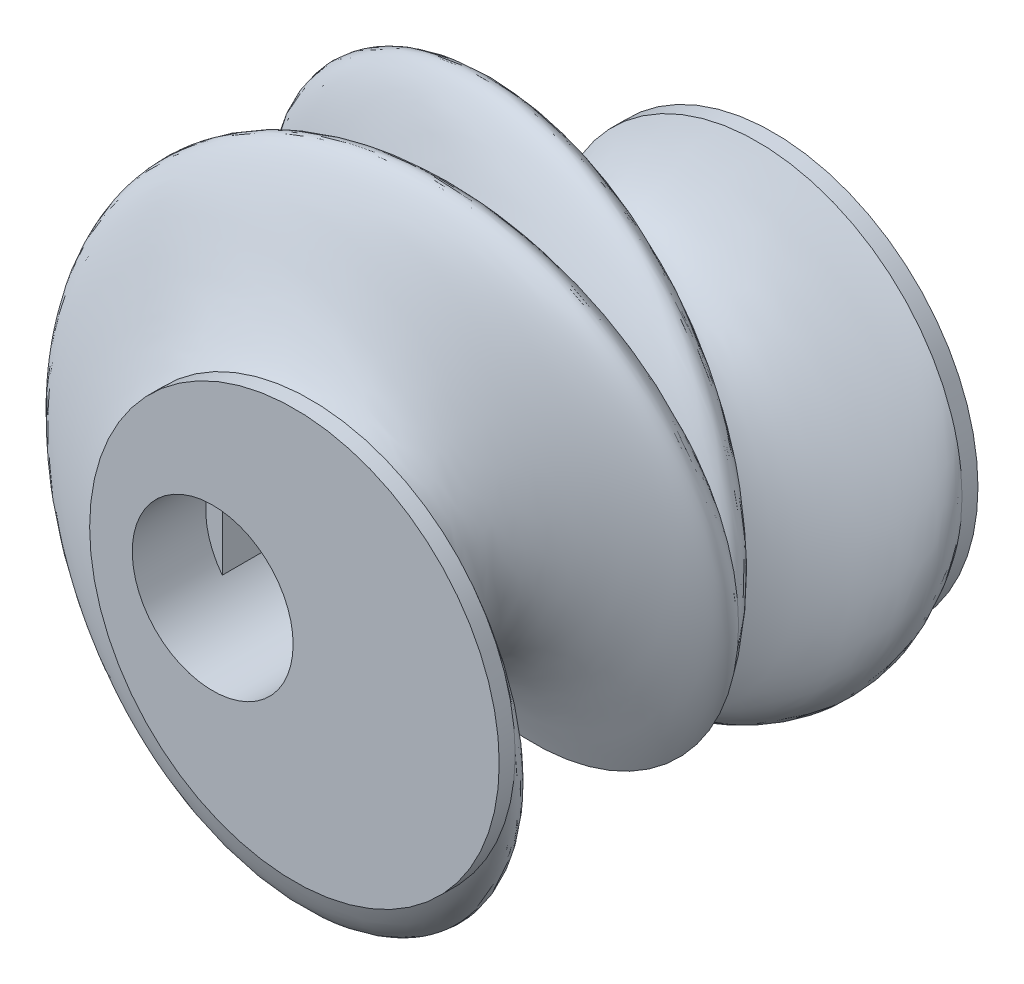
from build123d import *
from build123d.topology import SkipClean

# Parameters (mm, degrees)
AUSTRAGUNG1_PITCH               = 7
AUSTRAGUNG1_HEIGHT              = 7
AUSTRAGUNG1_RADIUS              = 3.5
SKIZZE1_R                       = 6.417321625
SKIZZE5_R                       = 2.5
SCHNITT_LINEAR_AUSTRAGEN1_DEPTH = 10
AUSTRAGUNG2_PITCH               = 7
AUSTRAGUNG2_HEIGHT              = 7
AUSTRAGUNG2_RADIUS              = 3.5
AUSTRAGUNG2_START_ANGLE         = 180
SKIZZE6_R                       = 6.417321625
SKIZZE8_R                       = 3.5
AUFSATZ_LINEAR_AUSTRAGEN1_DEPTH = 1.8
SKIZZE9_R                       = 2.6
SCHNITT_LINEAR_AUSTRAGEN2_DEPTH = 5
SKIZZE12_R                      = 2.52
SCHNITT_LINEAR_AUSTRAGEN4_DEPTH = 36
AUFSATZ_LINEAR_AUSTRAGEN2_DEPTH = 9
SKIZZE13_R                      = 6.417321625
SKIZZE13_R_2                    = 3.5
AUFSATZ_LINEAR_AUSTRAGEN3_DEPTH = 0.5
SKIZZE14_R                      = 6.417321625
SKIZZE14_R_2                    = 2.52
AUFSATZ_LINEAR_AUSTRAGEN4_DEPTH = 0.5


with BuildPart() as part:
    # Austragung1: sweep along a helix
    with BuildLine() as austragung1_path:
        Helix(AUSTRAGUNG1_PITCH, AUSTRAGUNG1_HEIGHT, AUSTRAGUNG1_RADIUS, center=(-2.561325, 0, 0), direction=(0, 0, 1))
    # Skizze1 → Austragung1 (sweep)
    with BuildSketch(Plane.XY):
        Circle(SKIZZE1_R)
    sweep(path=austragung1_path.line, is_frenet=True)

    # Skizze5 → Schnitt-Linear austragen1 (cut)
    with BuildSketch(Plane.XY.offset(7)):
        with Locations((-2.561325, 0)):
            Circle(SKIZZE5_R)
    extrude(amount=-SCHNITT_LINEAR_AUSTRAGEN1_DEPTH, mode=Mode.SUBTRACT)

    # Austragung2: sweep along a helix
    with BuildLine() as austragung2_path:
        add(Helix(AUSTRAGUNG2_PITCH, AUSTRAGUNG2_HEIGHT, AUSTRAGUNG2_RADIUS, center=(-2.561325, 0, 0), direction=(0, 0, -1), lefthand=True, mode=Mode.PRIVATE).rotate(Axis((-2.561325, 0, 0), (0, 0, -1)), AUSTRAGUNG2_START_ANGLE))
    # Skizze6 → Austragung2 (sweep)
    with BuildSketch(Plane(origin=(0, 0, 0), x_dir=(-1, 0, 0), z_dir=(0, 0, -1))):
        Circle(SKIZZE6_R)
    sweep(path=austragung2_path.line, is_frenet=True)

    # Skizze8 → Aufsatz-Linear austragen1 (add)
    with BuildSketch(Plane(origin=(0, 0, -7), x_dir=(-1, 0, 0), z_dir=(0, 0, -1))):
        with Locations((2.561325, 0)):
            Circle(SKIZZE8_R)
    extrude(amount=AUFSATZ_LINEAR_AUSTRAGEN1_DEPTH)

    # Skizze9 → Schnitt-Linear austragen2 (cut)
    with BuildSketch(Plane(origin=(0, 0, -8.8), x_dir=(-1, 0, 0), z_dir=(0, 0, -1))):
        with Locations((2.561325, 0)):
            Circle(SKIZZE9_R)
    extrude(amount=-SCHNITT_LINEAR_AUSTRAGEN2_DEPTH, mode=Mode.SUBTRACT)

    # Skizze12 → Schnitt-Linear austragen4 (cut)
    with BuildSketch(Plane(origin=(0, 0, -3.8), x_dir=(-1, 0, 0), z_dir=(0, 0, -1))):
        with Locations((2.561325, 0)):
            Circle(SKIZZE12_R)
    extrude(amount=-SCHNITT_LINEAR_AUSTRAGEN4_DEPTH, mode=Mode.SUBTRACT)

    # Skizze11 → Aufsatz-Linear austragen2 (add)
    with BuildSketch(Plane(origin=(0, 0, -3.8), x_dir=(-1, 0, 0), z_dir=(0, 0, -1))):
        Polygon((4.561325, -2.413407371), (5.761325, 0), (4.561325, 2.413407371), align=None)
    extrude(amount=-AUFSATZ_LINEAR_AUSTRAGEN2_DEPTH)

    # Skizze13 → Aufsatz-Linear austragen3 (add)
    with BuildSketch(Plane(origin=(0, 0, -7), x_dir=(-1, 0, 0), z_dir=(0, 0, -1))):
        Circle(SKIZZE13_R)
        with Locations((2.561325, 0)):
            Circle(SKIZZE13_R_2, mode=Mode.SUBTRACT)
    extrude(amount=AUFSATZ_LINEAR_AUSTRAGEN3_DEPTH)

    # Skizze14 → Aufsatz-Linear austragen4 (add)
    with SkipClean():  # the faces are left unmerged after this step: merging them gives an invalid solid
        with BuildSketch(Plane.XY.offset(7)):
            with Locations(Location((0, 0, 0), (0, 0, 180))):
                Circle(SKIZZE14_R)
            with Locations(Location((-2.561325, 0, 0), (0, 0, 217.471995183))):
                Circle(SKIZZE14_R_2, mode=Mode.SUBTRACT)
        extrude(amount=AUFSATZ_LINEAR_AUSTRAGEN4_DEPTH)


solid = part.part
